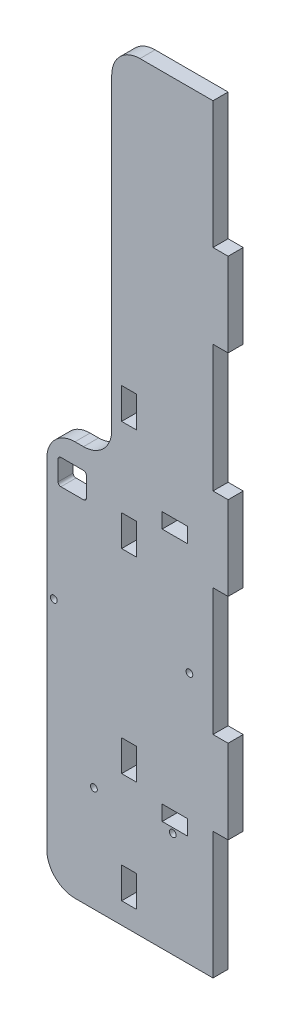
from build123d import *

# Parameters (mm, degrees)
MODEL_R             = 1.2
MODEL_W             = 5.35
MODEL_H             = 11
MODEL_W_2           = 9
MODEL_H_2           = 5.35
BOSS_EXTRUDE1_DEPTH = 5.35


with BuildPart() as part:
    # Model → Boss-Extrude1 (new body)
    with BuildSketch(Plane.XY):
        with BuildLine():
            Line((58.85, 269), (33, 269))
            ThreePointArc((33, 269), (25.928932188, 266.071067812), (23, 259))
            Line((23, 259), (23, 150))
            ThreePointArc((23, 150), (20.071067812, 142.928932188), (13, 140))
            Line((13, 140), (10, 140))
            ThreePointArc((10, 140), (2.928932188, 137.071067812), (0, 130))
            Line((0, 130), (0, 10))
            ThreePointArc((0, 10), (2.928932188, 2.928932188), (10, 0))
            Line((10, 0), (58.85, 0))
            Line((58.85, 0), (58.85, 45))
            Line((58.85, 45), (64.2, 45))
            Line((64.2, 45), (64.2, 74.666666667))
            Line((64.2, 74.666666667), (58.85, 74.666666667))
            Line((58.85, 74.666666667), (58.85, 119.666666667))
            Line((58.85, 119.666666667), (64.2, 119.666666667))
            Line((64.2, 119.666666667), (64.2, 149.333333333))
            Line((64.2, 149.333333333), (58.85, 149.333333333))
            Line((58.85, 149.333333333), (58.85, 194.333333333))
            Line((58.85, 194.333333333), (64.2, 194.333333333))
            Line((64.2, 194.333333333), (64.2, 224))
            Line((64.2, 224), (58.85, 224))
            Line((58.85, 224), (58.85, 269))
        make_face()
        with Locations((2.5, 88.027872499)):
            Circle(MODEL_R, mode=Mode.SUBTRACT)
        with Locations((44.6, 37.227872499)):
            Circle(MODEL_R, mode=Mode.SUBTRACT)
        with Locations((16.7, 37.227872499)):
            Circle(MODEL_R, mode=Mode.SUBTRACT)
        with Locations((50.5, 89.327872499)):
            Circle(MODEL_R, mode=Mode.SUBTRACT)
        with Locations((29.175, 160)):
            Rectangle(MODEL_W, MODEL_H, mode=Mode.SUBTRACT)
        with Locations((45.35, 131.325)):
            Rectangle(MODEL_W_2, MODEL_H_2, mode=Mode.SUBTRACT)
        with Locations((29.175, 121)):
            Rectangle(MODEL_W, MODEL_H, mode=Mode.SUBTRACT)
        with Locations((45.35, 41.675)):
            Rectangle(MODEL_W_2, MODEL_H_2, mode=Mode.SUBTRACT)
        with Locations((29.175, 52)):
            Rectangle(MODEL_W, MODEL_H, mode=Mode.SUBTRACT)
        with Locations((29.175, 13)):
            Rectangle(MODEL_W, MODEL_H, mode=Mode.SUBTRACT)
        with BuildLine():
            Line((5, 123.711859862), (13, 123.711859862))
            ThreePointArc((13, 123.711859862), (13.707106781, 124.004753081), (14, 124.711859862))
            Line((14, 124.711859862), (14, 131.711859862))
            ThreePointArc((14, 131.711859862), (13.707106781, 132.418966643), (13, 132.711859862))
            Line((13, 132.711859862), (5, 132.711859862))
            ThreePointArc((5, 132.711859862), (4.292893219, 132.418966643), (4, 131.711859862))
            Line((4, 131.711859862), (4, 124.711859862))
            ThreePointArc((4, 124.711859862), (4.292893219, 124.004753081), (5, 123.711859862))
        make_face(mode=Mode.SUBTRACT)
    extrude(amount=BOSS_EXTRUDE1_DEPTH)


solid = part.part
